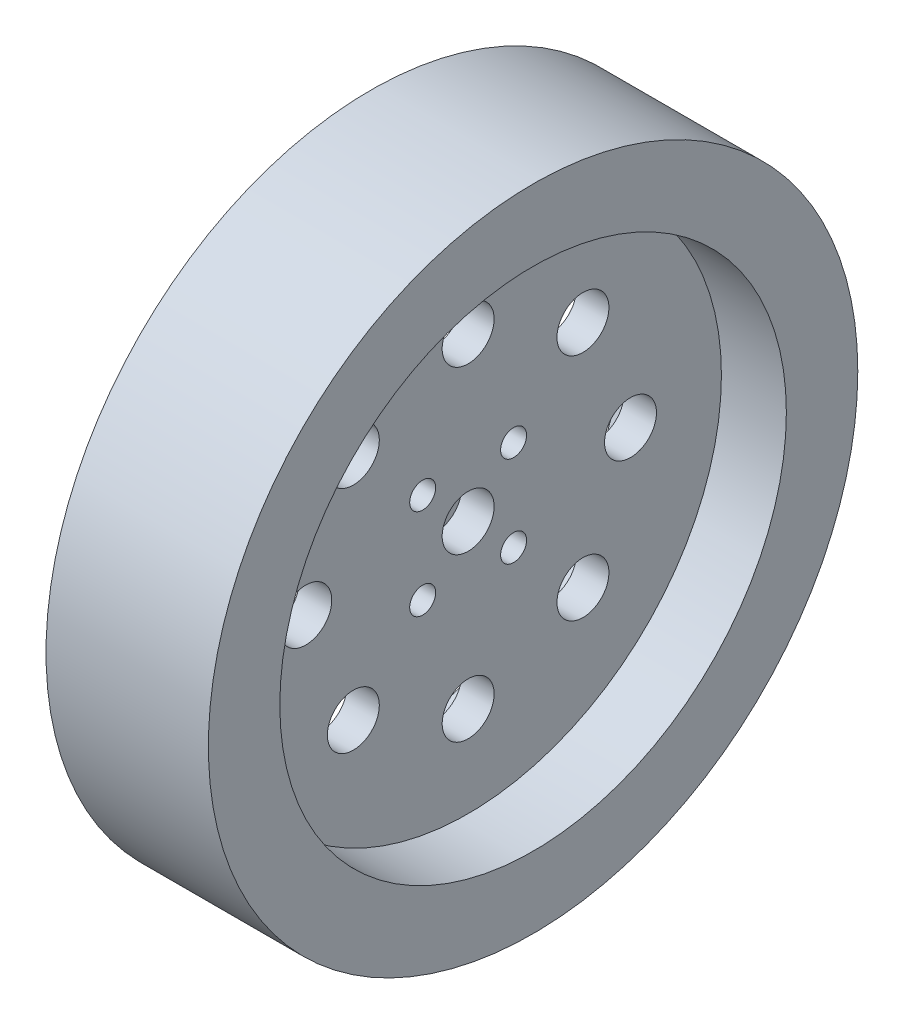
from build123d import *

# Parameters (mm, degrees)
ESQUISSE1_R                  = 50
BOSS_EXTRU_1_DEPTH           = 12.5
ESQUISSE3_R                  = 39
ENL_V_MAT_EXTRU_2_DEPTH      = 10
ESQUISSE4_R                  = 4
ENL_V_MAT_EXTRU_3_DEPTH      = 72.414284285
R_P_TITION_CIRCULAIRE1_COUNT = 8
ESQUISSE5_R                  = 4
ENL_V_MAT_EXTRU_4_DEPTH      = 72.414284285
ESQUISSE6_R                  = 2
ENL_V_MAT_EXTRU_5_DEPTH      = 72.414284285
R_P_TITION_CIRCULAIRE2_COUNT = 4
SYM_TRIE2_COPY_1_SKETCH_R    = 4
SYM_TRIE2_COPY_1_DEPTH       = 72.414284285
SYM_TRIE2_COPY_2_SKETCH_R    = 4
SYM_TRIE2_COPY_2_DEPTH       = 72.414284285
SYM_TRIE2_COPY_3_SKETCH_R    = 4
SYM_TRIE2_COPY_3_DEPTH       = 72.414284285
SYM_TRIE2_COPY_4_SKETCH_R    = 4
SYM_TRIE2_COPY_4_DEPTH       = 72.414284285
SYM_TRIE2_COPY_5_SKETCH_R    = 4
SYM_TRIE2_COPY_5_DEPTH       = 72.414284285
SYM_TRIE2_COPY_6_SKETCH_R    = 4
SYM_TRIE2_COPY_6_DEPTH       = 72.414284285
SYM_TRIE2_COPY_7_SKETCH_R    = 4
SYM_TRIE2_COPY_7_DEPTH       = 72.414284285
SYM_TRIE2_COPY_8_SKETCH_R    = 2
SYM_TRIE2_COPY_8_DEPTH       = 72.414284285
SYM_TRIE2_COPY_9_SKETCH_R    = 2
SYM_TRIE2_COPY_9_DEPTH       = 72.414284285
SYM_TRIE2_COPY_10_SKETCH_R   = 2
SYM_TRIE2_COPY_10_DEPTH      = 72.414284285
ESQUISSE7_R                  = 12.5
BOSS_EXTRU_2_DEPTH           = 8


with BuildPart() as part:
    # Esquisse1 → Boss.-Extru.1 (new body)
    with BuildSketch(Plane(origin=(0, 0, 0), x_dir=(0, 0, -1), z_dir=(1, 0, 0))):
        Circle(ESQUISSE1_R)
    boss_extru_1 = extrude(amount=BOSS_EXTRU_1_DEPTH)

    # Esquisse3 → Enlèv. mat.-Extru.2 (cut)
    with BuildSketch(Plane(origin=(12.5, 0, 0), x_dir=(0, 0, -1), z_dir=(1, 0, 0))):
        Circle(ESQUISSE3_R)
    enl_v_mat_extru_2 = extrude(amount=-ENL_V_MAT_EXTRU_2_DEPTH, mode=Mode.SUBTRACT)

    # Esquisse4 → Enlèv. mat.-Extru.3 (cut, through all)
    with BuildSketch(Plane(origin=(2.5, 0, 0), x_dir=(0, 0, -1), z_dir=(1, 0, 0))):
        with Locations((0, 25)):
            Circle(ESQUISSE4_R)
    enl_v_mat_extru_3 = extrude(amount=-ENL_V_MAT_EXTRU_3_DEPTH, mode=Mode.SUBTRACT)

    # Répétition circulaire1: Enlèv. mat.-Extru.3 ×8 about axis
    r_p_tition_circulaire1_axis = Axis((0, 0, 0), (1, 0, 0))
    for i in range(1, R_P_TITION_CIRCULAIRE1_COUNT):
        add(enl_v_mat_extru_3.rotate(r_p_tition_circulaire1_axis, i * 360 / R_P_TITION_CIRCULAIRE1_COUNT), mode=Mode.SUBTRACT)

    # Esquisse5 → Enlèv. mat.-Extru.4 (cut, through all)
    with BuildSketch(Plane(origin=(2.5, 0, 0), x_dir=(0, 0, -1), z_dir=(1, 0, 0))):
        Circle(ESQUISSE5_R)
    enl_v_mat_extru_4 = extrude(amount=-ENL_V_MAT_EXTRU_4_DEPTH, mode=Mode.SUBTRACT)

    # Esquisse6 → Enlèv. mat.-Extru.5 (cut, through all)
    with BuildSketch(Plane(origin=(2.5, 0, 0), x_dir=(0, 0, -1), z_dir=(1, 0, 0))):
        with Locations((-7, 7)):
            Circle(ESQUISSE6_R)
    enl_v_mat_extru_5 = extrude(amount=-ENL_V_MAT_EXTRU_5_DEPTH, mode=Mode.SUBTRACT)

    # Répétition circulaire2: Enlèv. mat.-Extru.5 ×4 about axis
    r_p_tition_circulaire2_axis = Axis((0, 0, 0), (1, 0, 0))
    for i in range(1, R_P_TITION_CIRCULAIRE2_COUNT):
        add(enl_v_mat_extru_5.rotate(r_p_tition_circulaire2_axis, i * 360 / R_P_TITION_CIRCULAIRE2_COUNT), mode=Mode.SUBTRACT)

    # Symétrie2: Boss.-Extru.1, Enlèv. mat.-Extru.2, Enlèv. mat.-Extru.3, Enlèv. mat.-Extru.4, Enlèv. mat.-Extru.5 across plane
    add(boss_extru_1.mirror(Plane(origin=(0, 0, 0), x_dir=(0, 0, 1), z_dir=(1, 0, 0))))
    add(enl_v_mat_extru_2.mirror(Plane(origin=(0, 0, 0), x_dir=(0, 0, 1), z_dir=(1, 0, 0))), mode=Mode.SUBTRACT)
    add(enl_v_mat_extru_3.mirror(Plane(origin=(0, 0, 0), x_dir=(0, 0, 1), z_dir=(1, 0, 0))), mode=Mode.SUBTRACT)
    add(enl_v_mat_extru_4.mirror(Plane(origin=(0, 0, 0), x_dir=(0, 0, 1), z_dir=(1, 0, 0))), mode=Mode.SUBTRACT)
    add(enl_v_mat_extru_5.mirror(Plane(origin=(0, 0, 0), x_dir=(0, 0, 1), z_dir=(1, 0, 0))), mode=Mode.SUBTRACT)

    # Symétrie2 copy 1 sketch → Symétrie2 copy 1 (cut, through all)
    with BuildSketch(Plane(origin=(-2.5, 0, 0), x_dir=(0, 0.7071067811865475, -0.7071067811865476), z_dir=(-1, 0, 0))):
        with Locations((0, -25)):
            Circle(SYM_TRIE2_COPY_1_SKETCH_R)
    extrude(amount=-SYM_TRIE2_COPY_1_DEPTH, mode=Mode.SUBTRACT)

    # Symétrie2 copy 2 sketch → Symétrie2 copy 2 (cut, through all)
    with BuildSketch(Plane(origin=(-2.5, 0, 0), x_dir=(0, 1, 0), z_dir=(-1, 0, 0))):
        with Locations((0, -25)):
            Circle(SYM_TRIE2_COPY_2_SKETCH_R)
    extrude(amount=-SYM_TRIE2_COPY_2_DEPTH, mode=Mode.SUBTRACT)

    # Symétrie2 copy 3 sketch → Symétrie2 copy 3 (cut, through all)
    with BuildSketch(Plane(origin=(-2.5, 0, 0), x_dir=(0, 0.7071067811865476, 0.7071067811865475), z_dir=(-1, 0, 0))):
        with Locations((0, -25)):
            Circle(SYM_TRIE2_COPY_3_SKETCH_R)
    extrude(amount=-SYM_TRIE2_COPY_3_DEPTH, mode=Mode.SUBTRACT)

    # Symétrie2 copy 4 sketch → Symétrie2 copy 4 (cut, through all)
    with BuildSketch(Plane.ZY.offset(2.5)):
        with Locations((0, -25)):
            Circle(SYM_TRIE2_COPY_4_SKETCH_R)
    extrude(amount=-SYM_TRIE2_COPY_4_DEPTH, mode=Mode.SUBTRACT)

    # Symétrie2 copy 5 sketch → Symétrie2 copy 5 (cut, through all)
    with BuildSketch(Plane(origin=(-2.5, 0, 0), x_dir=(0, -0.7071067811865475, 0.7071067811865477), z_dir=(-1, 0, 0))):
        with Locations((0, -25)):
            Circle(SYM_TRIE2_COPY_5_SKETCH_R)
    extrude(amount=-SYM_TRIE2_COPY_5_DEPTH, mode=Mode.SUBTRACT)

    # Symétrie2 copy 6 sketch → Symétrie2 copy 6 (cut, through all)
    with BuildSketch(Plane(origin=(-2.5, 0, 0), x_dir=(0, -1, 0), z_dir=(-1, 0, 0))):
        with Locations((0, -25)):
            Circle(SYM_TRIE2_COPY_6_SKETCH_R)
    extrude(amount=-SYM_TRIE2_COPY_6_DEPTH, mode=Mode.SUBTRACT)

    # Symétrie2 copy 7 sketch → Symétrie2 copy 7 (cut, through all)
    with BuildSketch(Plane(origin=(-2.5, 0, 0), x_dir=(0, -0.7071067811865477, -0.7071067811865474), z_dir=(-1, 0, 0))):
        with Locations((0, -25)):
            Circle(SYM_TRIE2_COPY_7_SKETCH_R)
    extrude(amount=-SYM_TRIE2_COPY_7_DEPTH, mode=Mode.SUBTRACT)

    # Symétrie2 copy 8 sketch → Symétrie2 copy 8 (cut, through all)
    with BuildSketch(Plane(origin=(-2.5, 0, 0), x_dir=(0, 1, 0), z_dir=(-1, 0, 0))):
        with Locations((-7, -7)):
            Circle(SYM_TRIE2_COPY_8_SKETCH_R)
    extrude(amount=-SYM_TRIE2_COPY_8_DEPTH, mode=Mode.SUBTRACT)

    # Symétrie2 copy 9 sketch → Symétrie2 copy 9 (cut, through all)
    with BuildSketch(Plane.ZY.offset(2.5)):
        with Locations((-7, -7)):
            Circle(SYM_TRIE2_COPY_9_SKETCH_R)
    extrude(amount=-SYM_TRIE2_COPY_9_DEPTH, mode=Mode.SUBTRACT)

    # Symétrie2 copy 10 sketch → Symétrie2 copy 10 (cut, through all)
    with BuildSketch(Plane(origin=(-2.5, 0, 0), x_dir=(0, -1, 0), z_dir=(-1, 0, 0))):
        with Locations((-7, -7)):
            Circle(SYM_TRIE2_COPY_10_SKETCH_R)
    extrude(amount=-SYM_TRIE2_COPY_10_DEPTH, mode=Mode.SUBTRACT)

    # Esquisse7 → Boss.-Extru.2 (add)
    with BuildSketch(Plane.ZY.offset(2.5)):
        Circle(ESQUISSE7_R)
    extrude(amount=BOSS_EXTRU_2_DEPTH)


solid = part.part
